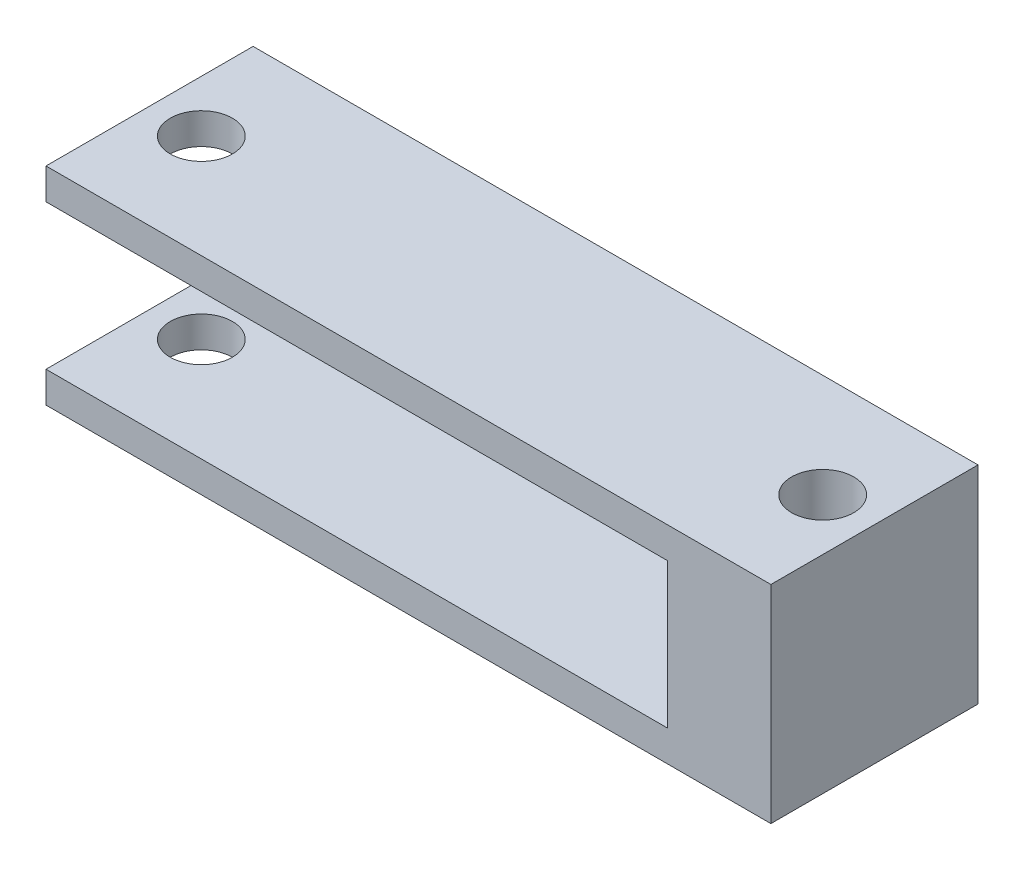
from build123d import *

# Parameters (mm, degrees)
SKETCH1_W           = 35
SKETCH1_H           = 10
SKETCH1_R           = 1.5
BOSS_EXTRUDE1_DEPTH = 10
SKETCH2_W           = 60
SKETCH2_H           = 7
CUT_EXTRUDE1_DEPTH  = 10


with BuildPart() as part:
    # Sketch1 → Boss-Extrude1 (new body)
    with BuildSketch(Plane(origin=(0, 0, 0), x_dir=(1, 0, 0), z_dir=(0, 1, 0))):
        Rectangle(SKETCH1_W, SKETCH1_H)
        with Locations(Location((-15, 0, 0), (0, 0, 270))):
            Circle(SKETCH1_R, mode=Mode.SUBTRACT)
        with Locations(Location((15, 0, 0), (0, 0, 270))):
            Circle(SKETCH1_R, mode=Mode.SUBTRACT)
    extrude(amount=BOSS_EXTRUDE1_DEPTH)

    # Sketch2 → Cut-Extrude1 (cut)
    with BuildSketch(Plane.XY.offset(5)):
        with Locations((-17.5, 5)):
            Rectangle(SKETCH2_W, SKETCH2_H)
    extrude(amount=-CUT_EXTRUDE1_DEPTH, mode=Mode.SUBTRACT)


solid = part.part
